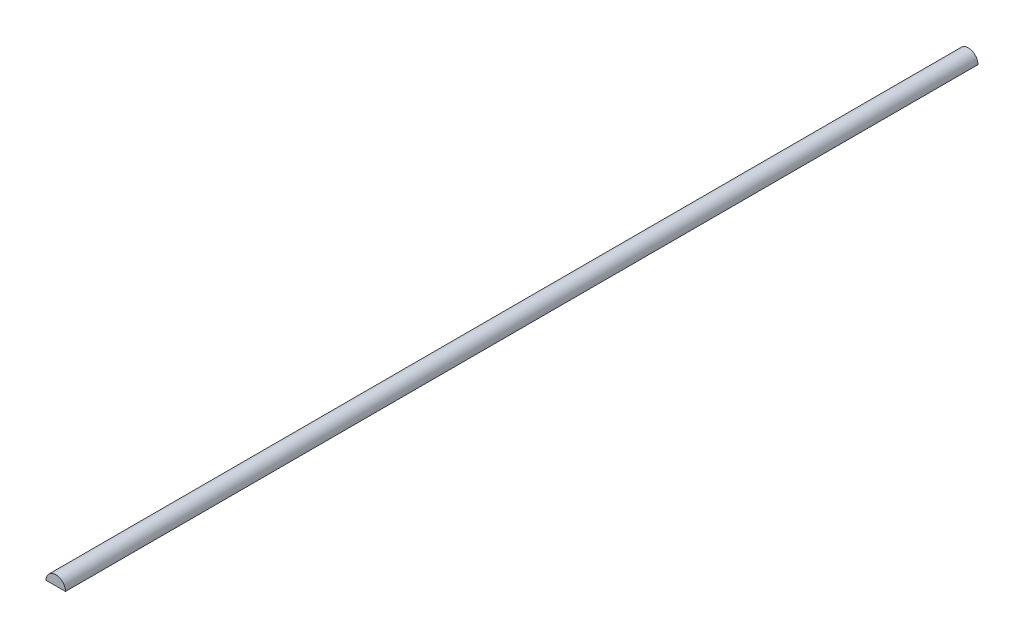
from build123d import *

# Parameters (mm, degrees)
BOSS_EXTRUDE1_DEPTH = 380


with BuildPart() as part:
    # Sketch1 → Boss-Extrude1 (new body)
    with BuildSketch(Plane.XY):
        with BuildLine():
            Line((0, 0), (4.05, 0))
            ThreePointArc((4.05, 0), (0, 4.05), (-4.05, 0))
            Line((-4.05, 0), (0, 0))
        make_face()
    extrude(amount=BOSS_EXTRUDE1_DEPTH)


solid = part.part
